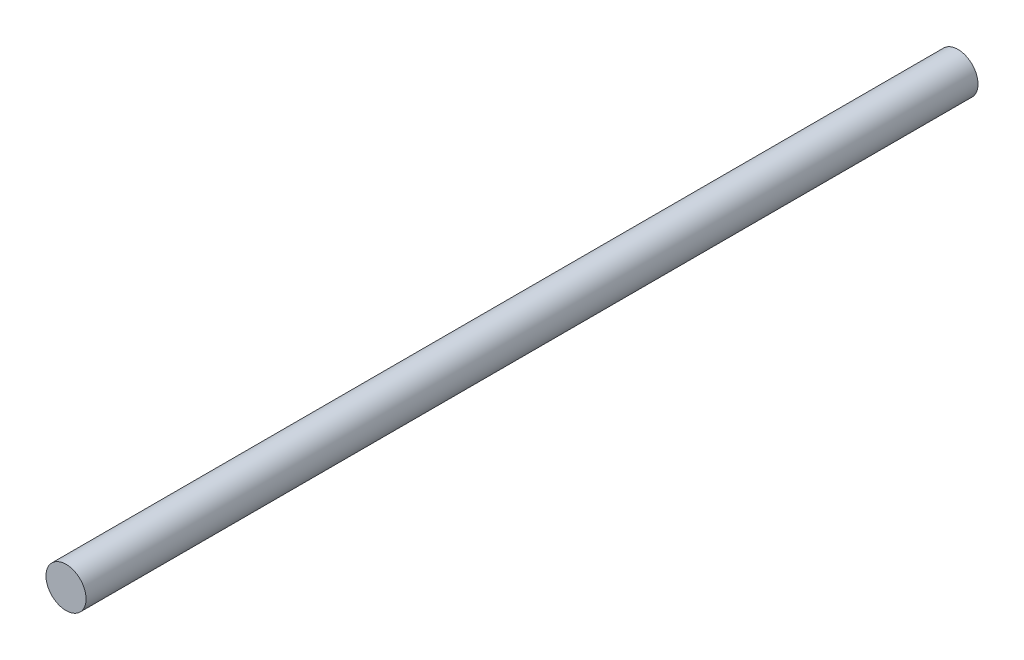
from build123d import *

# Parameters (mm, degrees)
SKETCH1_R           = 2.25
BOSS_EXTRUDE1_DEPTH = 100


with BuildPart() as part:
    # Sketch1 → Boss-Extrude1 (new body)
    with BuildSketch(Plane.XY):
        Circle(SKETCH1_R)
    extrude(amount=BOSS_EXTRUDE1_DEPTH)


solid = part.part
